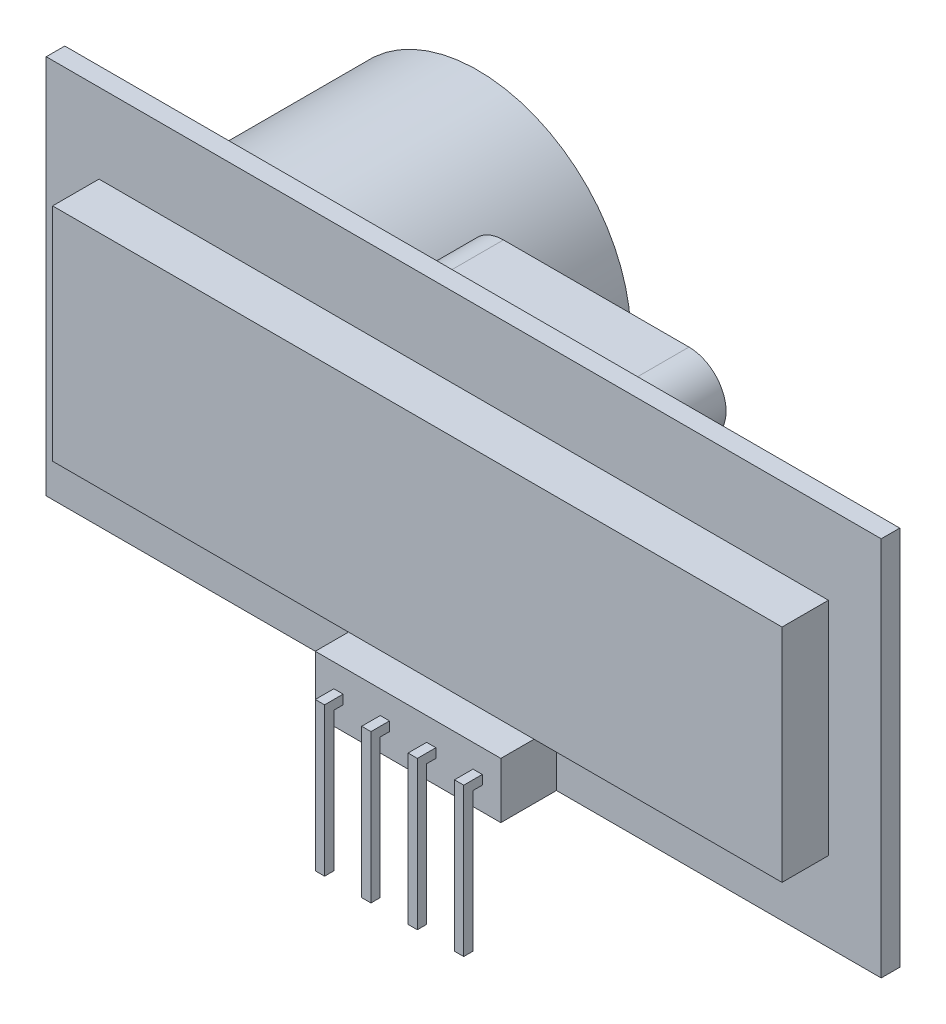
from build123d import *

# Parameters (mm, degrees)
SKETCH1_W           = 45
SKETCH1_H           = 20.5
BOSS_EXTRUDE1_DEPTH = 1
SKETCH3_R           = 8.25
BOSS_EXTRUDE2_DEPTH = 12
BOSS_EXTRUDE3_DEPTH = 3.5
SKETCH6_W           = 39.311963292
SKETCH6_H           = 11.9190527
BOSS_EXTRUDE4_DEPTH = 2.5
SKETCH7_W           = 10
SKETCH7_H           = 3
BOSS_EXTRUDE5_DEPTH = 3
SKETCH8_W           = 0.5
SKETCH8_H           = 0.5
BOSS_EXTRUDE6_DEPTH = 4
SKETCH9_W           = 9
SKETCH9_H           = 3
CUT_EXTRUDE1_DEPTH  = 4
SKETCH10_W          = 0.5
SKETCH10_H          = 0.5
BOSS_EXTRUDE7_DEPTH = 7.5


with BuildPart() as part:
    # Sketch1 → Boss-Extrude1 (new body)
    with BuildSketch(Plane.XY):
        Rectangle(SKETCH1_W, SKETCH1_H)
    extrude(amount=BOSS_EXTRUDE1_DEPTH)

    # Sketch3 → Boss-Extrude2 (add)
    with BuildSketch(Plane(origin=(0, 0, 0), x_dir=(-1, 0, 0), z_dir=(0, 0, -1))):
        with Locations((12.25, 0)):
            Circle(SKETCH3_R)
    extrude(amount=BOSS_EXTRUDE2_DEPTH)

    # Sketch4 → Boss-Extrude3 (add)
    with BuildSketch(Plane(origin=(0, 0, 0), x_dir=(-1, 0, 0), z_dir=(0, 0, -1))):
        with BuildLine():
            Line((-7.639519339, 9.518507805), (2.360480661, 9.518507805))
            ThreePointArc((2.360480661, 9.518507805), (4.360480661, 7.518507805), (2.360480661, 5.518507805))
            Line((2.360480661, 5.518507805), (-7.639519339, 5.518507805))
            ThreePointArc((-7.639519339, 5.518507805), (-9.639519339, 7.518507805), (-7.639519339, 9.518507805))
        make_face()
    extrude(amount=BOSS_EXTRUDE3_DEPTH)

    # Sketch6 → Boss-Extrude4 (add)
    with BuildSketch(Plane.XY.offset(1)):
        Rectangle(SKETCH6_W, SKETCH6_H)
    extrude(amount=BOSS_EXTRUDE4_DEPTH)

    # Sketch7 → Boss-Extrude5 (add)
    with BuildSketch(Plane.XY.offset(1)):
        with Locations((0, -8.75)):
            Rectangle(SKETCH7_W, SKETCH7_H)
    extrude(amount=BOSS_EXTRUDE5_DEPTH)

    # Sketch8 → Boss-Extrude6 (add)
    with BuildSketch(Plane.XY.offset(4)):
        with Locations((3.75, -8.75)):
            Rectangle(SKETCH8_W, SKETCH8_H)
        with Locations((-3.75, -8.75)):
            Rectangle(SKETCH8_W, SKETCH8_H)
        with Locations((1.25, -8.75)):
            Rectangle(SKETCH8_W, SKETCH8_H)
        with Locations((-1.25, -8.75)):
            Rectangle(SKETCH8_W, SKETCH8_H)
    extrude(amount=BOSS_EXTRUDE6_DEPTH)

    # Sketch9 → Cut-Extrude1 (cut)
    with BuildSketch(Plane.XZ.offset(10.25)):
        with Locations((-0.5, 6.5)):
            Rectangle(SKETCH9_W, SKETCH9_H)
    extrude(amount=-CUT_EXTRUDE1_DEPTH, mode=Mode.SUBTRACT)

    # Sketch10 → Boss-Extrude7 (add)
    with BuildSketch(Plane.XZ.offset(9)):
        with Locations((-3.75, 4.75)):
            Rectangle(SKETCH10_W, SKETCH10_H)
        with Locations((-1.25, 4.75)):
            Rectangle(SKETCH10_W, SKETCH10_H)
        with Locations((1.25, 4.75)):
            Rectangle(SKETCH10_W, SKETCH10_H)
        with Locations((3.75, 4.75)):
            Rectangle(SKETCH10_W, SKETCH10_H)
    extrude(amount=BOSS_EXTRUDE7_DEPTH)


solid = part.part
